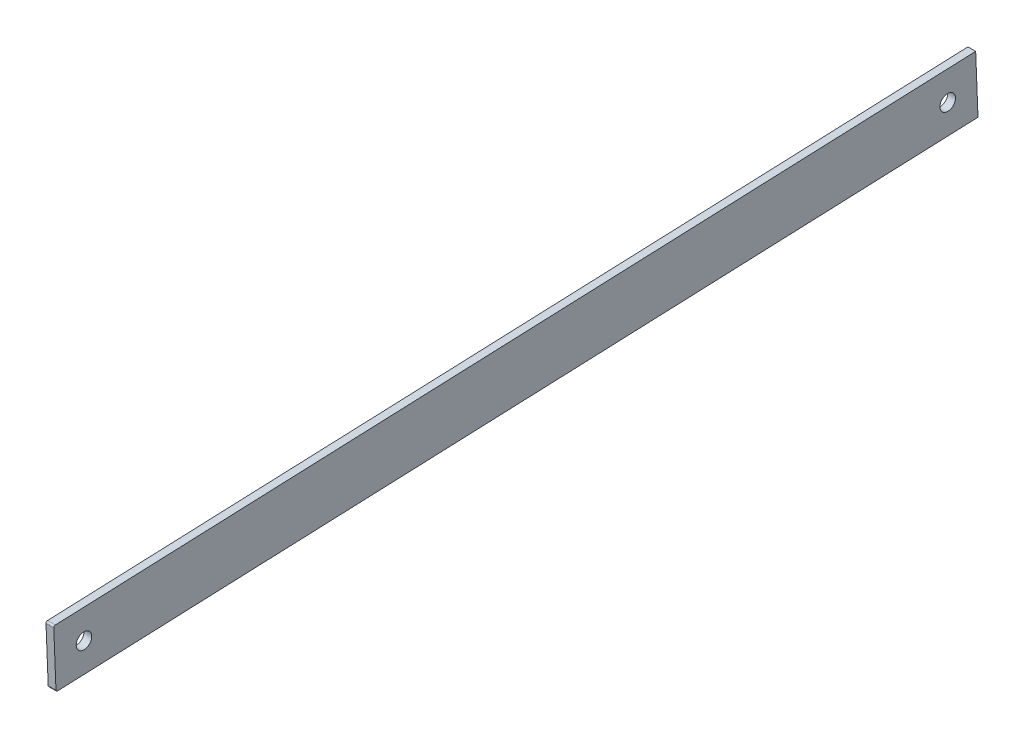
from build123d import *

# Parameters (mm, degrees)
SKETCH1_R           = 4
BOSS_EXTRUDE1_DEPTH = 4


with BuildPart() as part:
    # Sketch1 → Boss-Extrude1 (new body)
    with BuildSketch(Plane(origin=(1.4, 0, 0), x_dir=(0, -1, 0), z_dir=(-1, 0, 0))):
        with BuildLine():
            Line((-254.739115199, 199.375774934), (-224.762842625, 198.182844675))
            Line((-224.762842625, 198.182844675), (-205.908265943, 671.965721187))
            ThreePointArc((-205.908265943, 671.965721187), (-206.131039779, 672.570516328), (-206.716219414, 672.840646182))
            Line((-206.716219414, 672.840646182), (-235.009613521, 673.966604918))
            ThreePointArc((-235.009613521, 673.966604918), (-235.614408661, 673.743831082), (-235.884538516, 673.158651447))
            Line((-235.884538516, 673.158651447), (-254.739115199, 199.375774934))
        make_face()
        with Locations(Location((-221.459381597, 658.415489264, 0), (0, 0, 270))):
            Circle(SKETCH1_R, mode=Mode.SUBTRACT)
        with Locations(Location((-239.154513782, 213.767446091, 0), (0, 0, 270))):
            Circle(SKETCH1_R, mode=Mode.SUBTRACT)
    extrude(amount=-BOSS_EXTRUDE1_DEPTH)


solid = part.part
